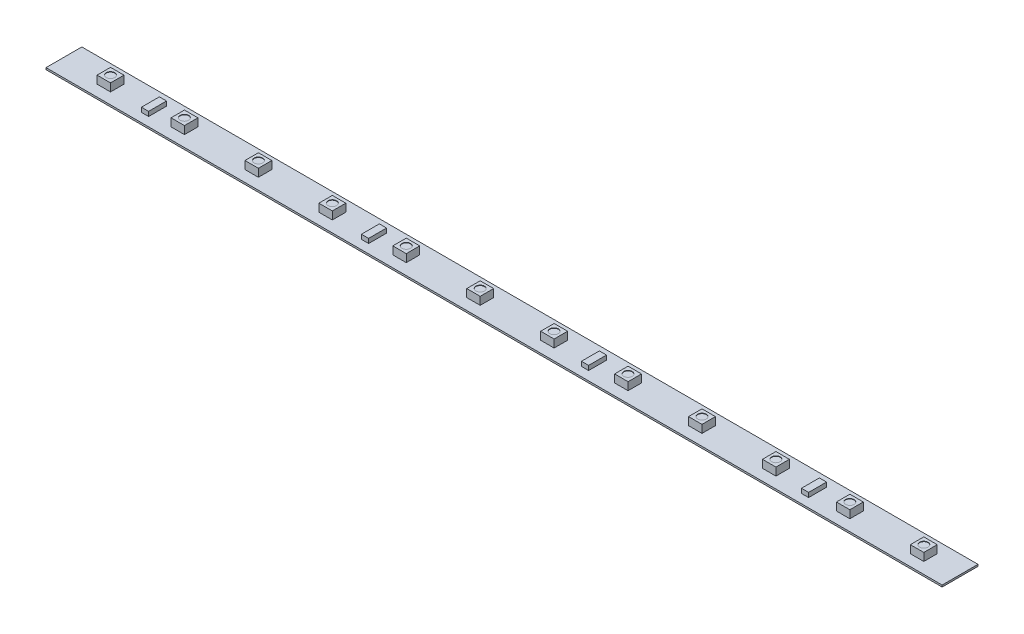
from build123d import *

# Parameters (mm, degrees)
SKETCH1_W           = 200
SKETCH1_H           = 8
BOSS_EXTRUDE1_DEPTH = 0.4
SKETCH2_W           = 3
SKETCH2_H           = 3
BOSS_EXTRUDE2_DEPTH = 1.75
SKETCH3_R           = 0.95
CUT_EXTRUDE1_DEPTH  = 0.1
LPATTERN1_COUNT     = 12
LPATTERN1_PITCH     = 16.5
SKETCH4_W           = 1.6
SKETCH4_H           = 4
BOSS_EXTRUDE3_DEPTH = 1
LPATTERN2_COUNT     = 4
LPATTERN2_PITCH     = 49.1


with BuildPart() as part:
    # Sketch1 → Boss-Extrude1 (new body)
    with BuildSketch(Plane(origin=(0, 0, 0), x_dir=(1, 0, 0), z_dir=(0, 1, 0))):
        Rectangle(SKETCH1_W, SKETCH1_H)
    extrude(amount=BOSS_EXTRUDE1_DEPTH)

    # Sketch2 → Boss-Extrude2 (add)
    with BuildSketch(Plane(origin=(0, 0.4, 0), x_dir=(1, 0, 0), z_dir=(0, 1, 0))):
        with Locations((91.9, 0)):
            Rectangle(SKETCH2_W, SKETCH2_H)
    boss_extrude2 = extrude(amount=BOSS_EXTRUDE2_DEPTH)

    # Sketch3 → Cut-Extrude1 (cut)
    with BuildSketch(Plane(origin=(0, 2.15, 0), x_dir=(1, 0, 0), z_dir=(0, 1, 0))):
        with Locations((91.9, 0)):
            Circle(SKETCH3_R)
    cut_extrude1 = extrude(amount=-CUT_EXTRUDE1_DEPTH, mode=Mode.SUBTRACT)

    # LPattern1: Boss-Extrude2, Cut-Extrude1 ×12
    with Locations(*[(-i * LPATTERN1_PITCH, 0, 0) for i in range(1, LPATTERN1_COUNT)]):
        add(boss_extrude2)
        add(cut_extrude1, mode=Mode.SUBTRACT)

    # Sketch4 → Boss-Extrude3 (add)
    with BuildSketch(Plane(origin=(0, 0.4, 0), x_dir=(1, 0, 0), z_dir=(0, 1, 0))):
        with Locations((67.4, 0)):
            Rectangle(SKETCH4_W, SKETCH4_H)
    boss_extrude3 = extrude(amount=BOSS_EXTRUDE3_DEPTH)

    # LPattern2: Boss-Extrude3 ×4
    with Locations(*[(-i * LPATTERN2_PITCH, 0, 0) for i in range(1, LPATTERN2_COUNT)]):
        add(boss_extrude3)


solid = part.part
